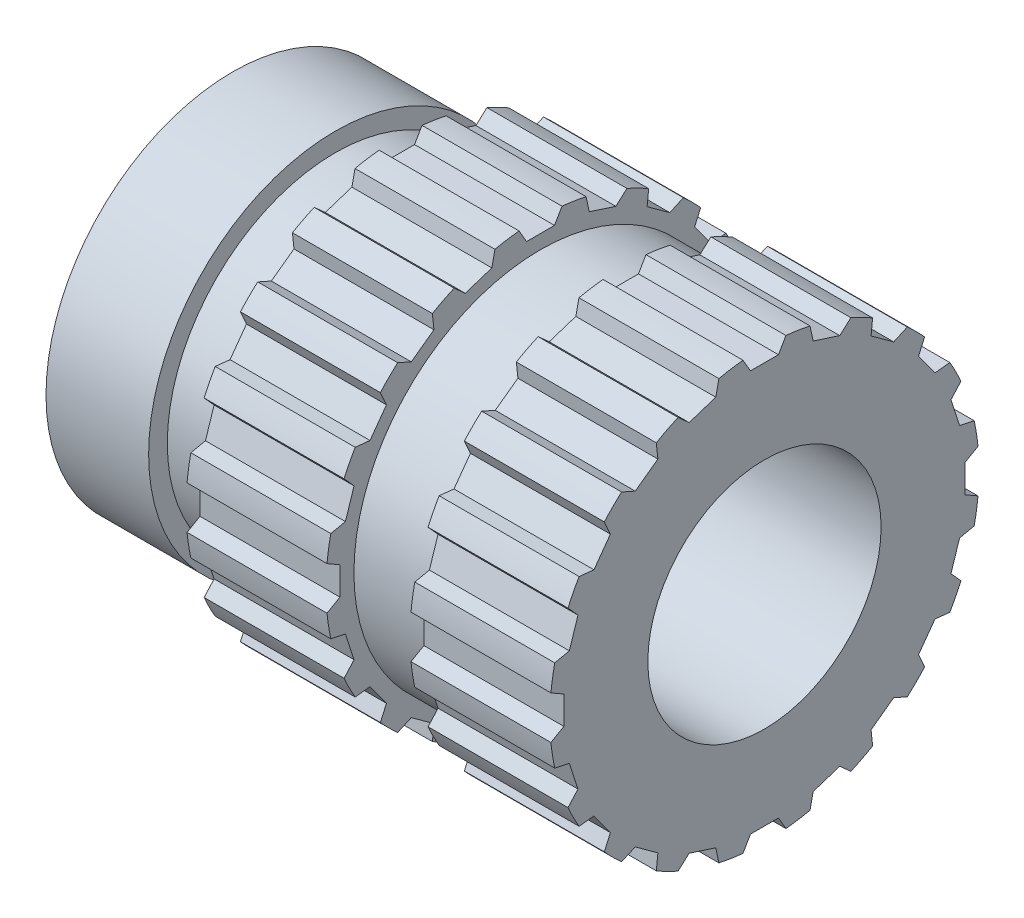
from build123d import *

# Parameters (mm, degrees)
M3X0_5_TAPPED_HOLE1_D = 2.5
CUT_EXTRUDE1_REACH    = 8.563
CIRPATTERN1_COUNT     = 20


with BuildPart() as part:
    # Sketch1 → Revolve1 (revolve)
    with BuildSketch(Plane.XY, mode=Mode.PRIVATE) as revolve1_sk:
        Polygon((-2.85, 0), (2.85, 0), (2.85, 2.3), (1.35, 2.3), (1.35, 2), (0.45, 2), (0.45, 2.3), (-1.05, 2.3), (-1.05, 1.8), (-1.75, 1.8), (-1.75, 2), (-2.85, 2), align=None)
    revolve(revolve1_sk.sketch.rotate(Axis((-2.85, 0, 0), (1, 0, 0)), 180), axis=Axis((-2.85, 0, 0), (1, 0, 0)))

    # M3x0.5 Tapped Hole1 (through all)
    with Locations(Plane(origin=(2.85, 0, 0), x_dir=(0, 0, -1), z_dir=(1, 0, 0))):
        with Locations((0, 0)):
            Hole(M3X0_5_TAPPED_HOLE1_D / 2)

    # Cut-Extrude1: up to this face of the body (flat: up to its plane)
    cut_extrude1_end = Plane(part.part.faces().sort_by_distance((-1.05, 2.234946176, 0))[0])
    # Sketch4 → Cut-Extrude1 (cut, up to the picked face)
    with BuildSketch(Plane(origin=(2.85, 0, 0), x_dir=(0, 0, -1), z_dir=(1, 0, 0)), mode=Mode.PRIVATE) as cut_extrude1_sk1:
        with BuildLine():
            Line((0.229949273, 2.288476203), (0.15, 2.15))
            Line((0.15, 2.15), (-0.15, 2.15))
            Line((-0.15, 2.15), (-0.229949273, 2.288476203))
            ThreePointArc((-0.229949273, 2.288476203), (0, 2.3), (0.229949273, 2.288476203))
        make_face()
    cut_extrude1_tool1 = split(extrude(cut_extrude1_sk1.sketch, amount=-CUT_EXTRUDE1_REACH, mode=Mode.PRIVATE), bisect_by=cut_extrude1_end, keep=Keep.BOTH, mode=Mode.PRIVATE)
    cut_extrude1 = cut_extrude1_tool1.solids().sort_by(Axis((2.85, 2.228438, 0), (-1, 0, 0)))[0]
    add(cut_extrude1, mode=Mode.SUBTRACT)

    # CirPattern1: Cut-Extrude1 ×20 about axis
    cirpattern1_axis = Axis((0, 0, 0), (1, 0, 0))
    for i in range(1, CIRPATTERN1_COUNT):
        add(cut_extrude1.rotate(cirpattern1_axis, i * 360 / CIRPATTERN1_COUNT), mode=Mode.SUBTRACT)


solid = part.part
